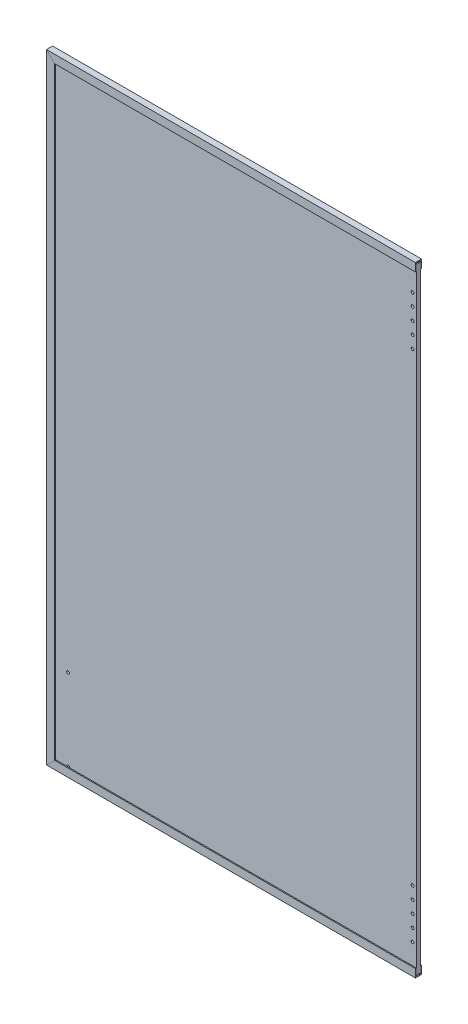
from build123d import *

# Parameters (mm, degrees)
SKETCH2_W                             = 574.675
SKETCH2_H                             = 965.2
FRAME_OUTER_DIMENSIONS_DEPTH          = 4.7625
SKETCH3_W                             = 561.975
SKETCH3_H                             = 939.8
FRAME_INNER_DIMENSIONS_DEPTH          = 1115.117407693
FRAME_PROFILE_DEPTH                   = 3.175
FRAME_PROFILE_DEPTH_BACK              = 3.175
SKETCH4_W                             = 573.0875
SKETCH4_H                             = 962.025
FRAME_SECTION_SPLIT_SURFACE_1_1_BACK  = 1124.367
FRAME_SECTION_SPLIT_SURFACE_1_1_DEPTH = 2248.734
FRAME_SECTION_SPLIT_SURFACE_1_2_BACK  = 1124.367
FRAME_SECTION_SPLIT_SURFACE_1_2_DEPTH = 2248.734
FRAME_SECTION_SPLIT_SURFACE_2_3_BACK  = 1124.367
FRAME_SECTION_SPLIT_SURFACE_2_3_DEPTH = 2248.734
FRAME_SECTION_SPLIT_SURFACE_2_4_BACK  = 1124.367
FRAME_SECTION_SPLIT_SURFACE_2_4_DEPTH = 2248.734
SKETCH5_W                             = 571.5
SKETCH5_H                             = 958.85
DOOR_PANEL_DEPTH                      = 2.794
SKETCH9_W                             = 2.2479
SKETCH9_H                             = 7.5565
F_8_CLEARANCE_HOLE1_AT_2_COUNT        = 2
F_8_CLEARANCE_HOLE1_AT_2_PITCH        = 19.05
F_8_CLEARANCE_HOLE1_AT_3_COUNT        = 2
F_8_CLEARANCE_HOLE1_AT_3_PITCH        = 38.1
F_8_CLEARANCE_HOLE1_AT_4_COUNT        = 2
F_8_CLEARANCE_HOLE1_AT_4_PITCH        = 57.15
F_8_CLEARANCE_HOLE1_AT_5_COUNT        = 2
F_8_CLEARANCE_HOLE1_AT_5_PITCH        = 76.2
F_8_CLEARANCE_HOLE1_AT_6_COUNT        = 2
F_8_CLEARANCE_HOLE1_AT_6_PITCH        = 819.15
F_8_CLEARANCE_HOLE1_AT_7_COUNT        = 2
F_8_CLEARANCE_HOLE1_AT_7_PITCH        = 838.2
F_8_CLEARANCE_HOLE1_AT_8_COUNT        = 2
F_8_CLEARANCE_HOLE1_AT_8_PITCH        = 857.25
F_8_CLEARANCE_HOLE1_AT_9_COUNT        = 2
F_8_CLEARANCE_HOLE1_AT_9_PITCH        = 876.3
F_8_CLEARANCE_HOLE1_AT_10_COUNT       = 2
F_8_CLEARANCE_HOLE1_AT_10_PITCH       = 800.1
SKETCH12_W                            = 2.2479
SKETCH12_H                            = 7.5565
F_8_CLEARANCE_HOLE2_AT_2_COUNT        = 2
F_8_CLEARANCE_HOLE2_AT_2_PITCH        = 127


with BuildPart() as part:
    # Sketch2 → Frame outer dimensions (new, symmetric)
    with BuildSketch(Plane.XY):
        with Locations((290.5125, 469.9)):
            Rectangle(SKETCH2_W, SKETCH2_H)
    extrude(amount=FRAME_OUTER_DIMENSIONS_DEPTH, both=True)

    # Sketch3 → Frame inner dimensions (cut, through all)
    with BuildSketch(Plane.XY.offset(4.7625)):
        with Locations((296.8625, 469.9)):
            Rectangle(SKETCH3_W, SKETCH3_H)
    extrude(amount=-FRAME_INNER_DIMENSIONS_DEPTH, mode=Mode.SUBTRACT)

    # Sketch4 → Frame profile (cut, two sides: drawn at the far end of the back side and taken through both)
    with BuildSketch(Plane.XY.offset(-FRAME_PROFILE_DEPTH_BACK)):
        with Locations((291.30625, 469.9)):
            Rectangle(SKETCH4_W, SKETCH4_H)
    extrude(amount=FRAME_PROFILE_DEPTH + FRAME_PROFILE_DEPTH_BACK, mode=Mode.SUBTRACT)


with BuildPart() as body_2:
    # Frame section split: the piece behind the surface
    add(part.part)
    # Frame section split surface 1: a surface, the sketch's curves swept straight by 2248.734 mm
    with BuildLine(Plane.XY.offset(4.7625).offset(-FRAME_SECTION_SPLIT_SURFACE_1_1_BACK), mode=Mode.PRIVATE) as frame_section_split_surface_1_1_path:
        Line((3.175, 952.5), (15.875, 939.8))
    frame_section_split_surface_1_1 = Shell.extrude(frame_section_split_surface_1_1_path.wire(), (0 * FRAME_SECTION_SPLIT_SURFACE_1_1_DEPTH, 0 * FRAME_SECTION_SPLIT_SURFACE_1_1_DEPTH, 1 * FRAME_SECTION_SPLIT_SURFACE_1_1_DEPTH))
    split(bisect_by=frame_section_split_surface_1_1, keep=Keep.BOTTOM)


with BuildPart() as part_1:
    add(part.part)

    # Frame section split: split by a surface, the side it looks to stays
    # Frame section split surface 1: a surface, the sketch's curves swept straight by 2248.734 mm
    with BuildLine(Plane.XY.offset(4.7625).offset(-FRAME_SECTION_SPLIT_SURFACE_1_2_BACK), mode=Mode.PRIVATE) as frame_section_split_surface_1_2_path:
        Line((3.175, 952.5), (15.875, 939.8))
    frame_section_split_surface_1_2 = Shell.extrude(frame_section_split_surface_1_2_path.wire(), (0 * FRAME_SECTION_SPLIT_SURFACE_1_2_DEPTH, 0 * FRAME_SECTION_SPLIT_SURFACE_1_2_DEPTH, 1 * FRAME_SECTION_SPLIT_SURFACE_1_2_DEPTH))
    split(bisect_by=frame_section_split_surface_1_2, keep=Keep.TOP)


with BuildPart() as body_3:
    # Frame section split 2 body 2: the piece behind the surface
    add(body_2.part)
    # Frame section split surface 2: a surface, the sketch's curves swept straight by 2248.734 mm
    with BuildLine(Plane.XY.offset(4.7625).offset(-FRAME_SECTION_SPLIT_SURFACE_2_3_BACK), mode=Mode.PRIVATE) as frame_section_split_surface_2_3_path:
        Line((3.175, -12.7), (15.875, 0))
    frame_section_split_surface_2_3 = Shell.extrude(frame_section_split_surface_2_3_path.wire(), (0 * FRAME_SECTION_SPLIT_SURFACE_2_3_DEPTH, 0 * FRAME_SECTION_SPLIT_SURFACE_2_3_DEPTH, 1 * FRAME_SECTION_SPLIT_SURFACE_2_3_DEPTH))
    split(bisect_by=frame_section_split_surface_2_3, keep=Keep.BOTTOM)


with BuildPart() as body_2_1:
    add(body_2.part)

    # Frame section split 2 body 2: split by a surface, the side it looks to stays
    # Frame section split surface 2: a surface, the sketch's curves swept straight by 2248.734 mm
    with BuildLine(Plane.XY.offset(4.7625).offset(-FRAME_SECTION_SPLIT_SURFACE_2_4_BACK), mode=Mode.PRIVATE) as frame_section_split_surface_2_4_path:
        Line((3.175, -12.7), (15.875, 0))
    frame_section_split_surface_2_4 = Shell.extrude(frame_section_split_surface_2_4_path.wire(), (0 * FRAME_SECTION_SPLIT_SURFACE_2_4_DEPTH, 0 * FRAME_SECTION_SPLIT_SURFACE_2_4_DEPTH, 1 * FRAME_SECTION_SPLIT_SURFACE_2_4_DEPTH))
    split(bisect_by=frame_section_split_surface_2_4, keep=Keep.TOP)


with BuildPart() as body_4:
    # Sketch5 → Door panel (new, symmetric)
    with BuildSketch(Plane.XY):
        with Locations((292.1, 469.9)):
            Rectangle(SKETCH5_W, SKETCH5_H)
    extrude(amount=DOOR_PANEL_DEPTH, both=True)

    # Sketch9 → #8 Clearance Hole1 (revolve, cut)
    with BuildSketch(Plane(origin=(571.5, 31.75, 2.794), x_dir=(0, -1, 0), z_dir=(1, 0, 0))):
        with Locations((1.12395, 3.77825)):
            Rectangle(SKETCH9_W, SKETCH9_H)
    f_8_clearance_hole1 = revolve(axis=Axis((571.5, 31.75, 9.144), (0, 0, -1)), mode=Mode.SUBTRACT)

    # #8 Clearance Hole1 at 2: #8 Clearance Hole1 ×2
    with Locations(*[(0, i * F_8_CLEARANCE_HOLE1_AT_2_PITCH, 0) for i in range(1, F_8_CLEARANCE_HOLE1_AT_2_COUNT)]):
        add(f_8_clearance_hole1, mode=Mode.SUBTRACT)

    # #8 Clearance Hole1 at 3: #8 Clearance Hole1 ×2
    with Locations(*[(0, i * F_8_CLEARANCE_HOLE1_AT_3_PITCH, 0) for i in range(1, F_8_CLEARANCE_HOLE1_AT_3_COUNT)]):
        add(f_8_clearance_hole1, mode=Mode.SUBTRACT)

    # #8 Clearance Hole1 at 4: #8 Clearance Hole1 ×2
    with Locations(*[(0, i * F_8_CLEARANCE_HOLE1_AT_4_PITCH, 0) for i in range(1, F_8_CLEARANCE_HOLE1_AT_4_COUNT)]):
        add(f_8_clearance_hole1, mode=Mode.SUBTRACT)

    # #8 Clearance Hole1 at 5: #8 Clearance Hole1 ×2
    with Locations(*[(0, i * F_8_CLEARANCE_HOLE1_AT_5_PITCH, 0) for i in range(1, F_8_CLEARANCE_HOLE1_AT_5_COUNT)]):
        add(f_8_clearance_hole1, mode=Mode.SUBTRACT)

    # #8 Clearance Hole1 at 6: #8 Clearance Hole1 ×2
    with Locations(*[(0, i * F_8_CLEARANCE_HOLE1_AT_6_PITCH, 0) for i in range(1, F_8_CLEARANCE_HOLE1_AT_6_COUNT)]):
        add(f_8_clearance_hole1, mode=Mode.SUBTRACT)

    # #8 Clearance Hole1 at 7: #8 Clearance Hole1 ×2
    with Locations(*[(0, i * F_8_CLEARANCE_HOLE1_AT_7_PITCH, 0) for i in range(1, F_8_CLEARANCE_HOLE1_AT_7_COUNT)]):
        add(f_8_clearance_hole1, mode=Mode.SUBTRACT)

    # #8 Clearance Hole1 at 8: #8 Clearance Hole1 ×2
    with Locations(*[(0, i * F_8_CLEARANCE_HOLE1_AT_8_PITCH, 0) for i in range(1, F_8_CLEARANCE_HOLE1_AT_8_COUNT)]):
        add(f_8_clearance_hole1, mode=Mode.SUBTRACT)

    # #8 Clearance Hole1 at 9: #8 Clearance Hole1 ×2
    with Locations(*[(0, i * F_8_CLEARANCE_HOLE1_AT_9_PITCH, 0) for i in range(1, F_8_CLEARANCE_HOLE1_AT_9_COUNT)]):
        add(f_8_clearance_hole1, mode=Mode.SUBTRACT)

    # #8 Clearance Hole1 at 10: #8 Clearance Hole1 ×2
    with Locations(*[(0, i * F_8_CLEARANCE_HOLE1_AT_10_PITCH, 0) for i in range(1, F_8_CLEARANCE_HOLE1_AT_10_COUNT)]):
        add(f_8_clearance_hole1, mode=Mode.SUBTRACT)

    # Sketch12 → #8 Clearance Hole2 (revolve, cut)
    with BuildSketch(Plane(origin=(34.925, 0, 2.794), x_dir=(0, -1, 0), z_dir=(1, 0, 0))):
        with Locations((1.12395, 3.77825)):
            Rectangle(SKETCH12_W, SKETCH12_H)
    f_8_clearance_hole2 = revolve(axis=Axis((34.925, 0, 9.144), (0, 0, -1)), mode=Mode.SUBTRACT)

    # #8 Clearance Hole2 at 2: #8 Clearance Hole2 ×2
    with Locations(*[(0, i * F_8_CLEARANCE_HOLE2_AT_2_PITCH, 0) for i in range(1, F_8_CLEARANCE_HOLE2_AT_2_COUNT)]):
        add(f_8_clearance_hole2, mode=Mode.SUBTRACT)


with BuildPart() as body_5:
    # Mirror1: mirrored copy
    add(part_1.part.mirror(Plane(origin=(0, 0, 0), x_dir=(0, 0, 1), z_dir=(1, 0, 0))))


with BuildPart() as body_6:
    # Mirror1 2: mirrored copy
    add(body_2_1.part.mirror(Plane(origin=(0, 0, 0), x_dir=(0, 0, 1), z_dir=(1, 0, 0))))


with BuildPart() as body_7:
    # Mirror1 3: mirrored copy
    add(body_3.part.mirror(Plane(origin=(0, 0, 0), x_dir=(0, 0, 1), z_dir=(1, 0, 0))))


with BuildPart() as body_8:
    # Mirror1 4: mirrored copy
    add(body_4.part.mirror(Plane(origin=(0, 0, 0), x_dir=(0, 0, 1), z_dir=(1, 0, 0))))


solid = Compound([part_1.part, body_3.part, body_2_1.part, body_4.part])
